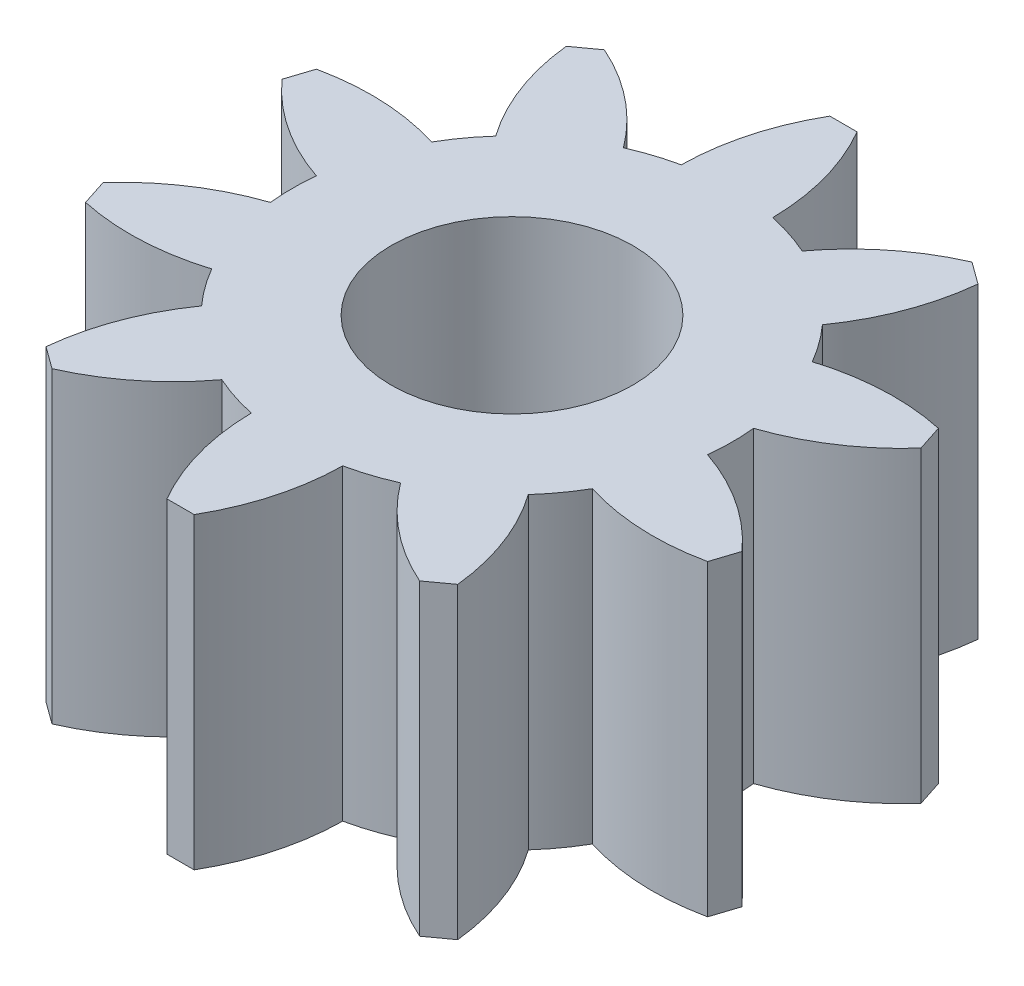
from build123d import *

# Parameters (mm, degrees)
SKETCH1_R           = 2.75
BOSS_EXTRUDE1_DEPTH = 7
SKETCH2_R           = 2.75
SKETCH2_R_2         = 1.75
BOSS_EXTRUDE2_DEPTH = 2


with BuildPart() as part:
    # Sketch1 → Boss-Extrude1 (new body)
    with BuildSketch(Plane(origin=(0, 0, 0), x_dir=(1, 0, 0), z_dir=(0, 1, 0))):
        with BuildLine():
            ThreePointArc((-1.04, 4.890644129), (-1.545084972, 4.755282581), (-2.033270819, 4.567910876))
            ThreePointArc((-2.033270819, 4.567910876), (-2.996312027, 5.563972943), (-4.181105534, 6.282201566))
            Line((-4.181105534, 6.282201566), (-4.682696071, 5.917774709))
            ThreePointArc((-4.682696071, 5.917774709), (-4.365741387, 4.569024274), (-3.716026168, 3.345317552))
            ThreePointArc((-3.716026168, 3.345317552), (-4.045084972, 2.938926261), (-4.329901294, 2.500390926))
            ThreePointArc((-4.329901294, 2.500390926), (-5.69448859, 2.740160647), (-7.075170865, 2.624815658))
            Line((-7.075170865, 2.624815658), (-7.266761401, 2.035160618))
            ThreePointArc((-7.266761401, 2.035160618), (-6.217564061, 1.130299882), (-4.972656642, 0.522193372))
            ThreePointArc((-4.972656642, 0.522193372), (-5, 0), (-4.972656642, -0.522193372))
            ThreePointArc((-4.972656642, -0.522193372), (-6.217564061, -1.130299882), (-7.266761401, -2.035160618))
            Line((-7.266761401, -2.035160618), (-7.075170865, -2.624815658))
            ThreePointArc((-7.075170865, -2.624815658), (-5.69448859, -2.740160647), (-4.329901294, -2.500390926))
            ThreePointArc((-4.329901294, -2.500390926), (-4.045084972, -2.938926261), (-3.716026168, -3.345317552))
            ThreePointArc((-3.716026168, -3.345317552), (-4.365741387, -4.569024274), (-4.682696071, -5.917774709))
            Line((-4.682696071, -5.917774709), (-4.181105534, -6.282201566))
            ThreePointArc((-4.181105534, -6.282201566), (-2.996312027, -5.563972943), (-2.033270819, -4.567910876))
            ThreePointArc((-2.033270819, -4.567910876), (-1.545084972, -4.755282581), (-1.04, -4.890644129))
            ThreePointArc((-1.04, -4.890644129), (-0.84635389, -6.262536688), (-0.31, -7.54))
            Line((-0.31, -7.54), (0.31, -7.54))
            ThreePointArc((0.31, -7.54), (0.84635389, -6.262536688), (1.04, -4.890644129))
            ThreePointArc((1.04, -4.890644129), (1.545084972, -4.755282581), (2.033270819, -4.567910876))
            ThreePointArc((2.033270819, -4.567910876), (2.996312027, -5.563972943), (4.181105534, -6.282201566))
            Line((4.181105534, -6.282201566), (4.682696071, -5.917774709))
            ThreePointArc((4.682696071, -5.917774709), (4.365741387, -4.569024274), (3.716026168, -3.345317552))
            ThreePointArc((3.716026168, -3.345317552), (4.045084972, -2.938926261), (4.329901294, -2.500390926))
            ThreePointArc((4.329901294, -2.500390926), (5.69448859, -2.740160647), (7.075170865, -2.624815658))
            Line((7.075170865, -2.624815658), (7.266761401, -2.035160618))
            ThreePointArc((7.266761401, -2.035160618), (6.217564061, -1.130299882), (4.972656642, -0.522193372))
            ThreePointArc((4.972656642, -0.522193372), (5, 0), (4.972656642, 0.522193372))
            ThreePointArc((4.972656642, 0.522193372), (6.217564061, 1.130299882), (7.266761401, 2.035160618))
            Line((7.266761401, 2.035160618), (7.075170865, 2.624815658))
            ThreePointArc((7.075170865, 2.624815658), (5.69448859, 2.740160647), (4.329901294, 2.500390926))
            ThreePointArc((4.329901294, 2.500390926), (4.045084972, 2.938926261), (3.716026168, 3.345317552))
            ThreePointArc((3.716026168, 3.345317552), (4.365741387, 4.569024274), (4.682696071, 5.917774709))
            Line((4.682696071, 5.917774709), (4.181105534, 6.282201566))
            ThreePointArc((4.181105534, 6.282201566), (2.996312027, 5.563972943), (2.033270819, 4.567910876))
            ThreePointArc((2.033270819, 4.567910876), (1.545084972, 4.755282581), (1.04, 4.890644129))
            ThreePointArc((1.04, 4.890644129), (0.84635389, 6.262536688), (0.31, 7.54))
            Line((0.31, 7.54), (-0.31, 7.54))
            ThreePointArc((-0.31, 7.54), (-0.84635389, 6.262536688), (-1.04, 4.890644129))
        make_face()
        with Locations(Location((0, 0, 0), (0, 0, 270))):
            Circle(SKETCH1_R, mode=Mode.SUBTRACT)
    extrude(amount=BOSS_EXTRUDE1_DEPTH)

    # Sketch2 → Boss-Extrude2 (add)
    with BuildSketch(Plane.XZ):
        with Locations(Location((0, 0, 0), (0, 0, 270))):
            Circle(SKETCH2_R)
        with Locations(Location((0, 0, 0), (0, 0, 270))):
            Circle(SKETCH2_R_2, mode=Mode.SUBTRACT)
    extrude(amount=-BOSS_EXTRUDE2_DEPTH)


solid = part.part
